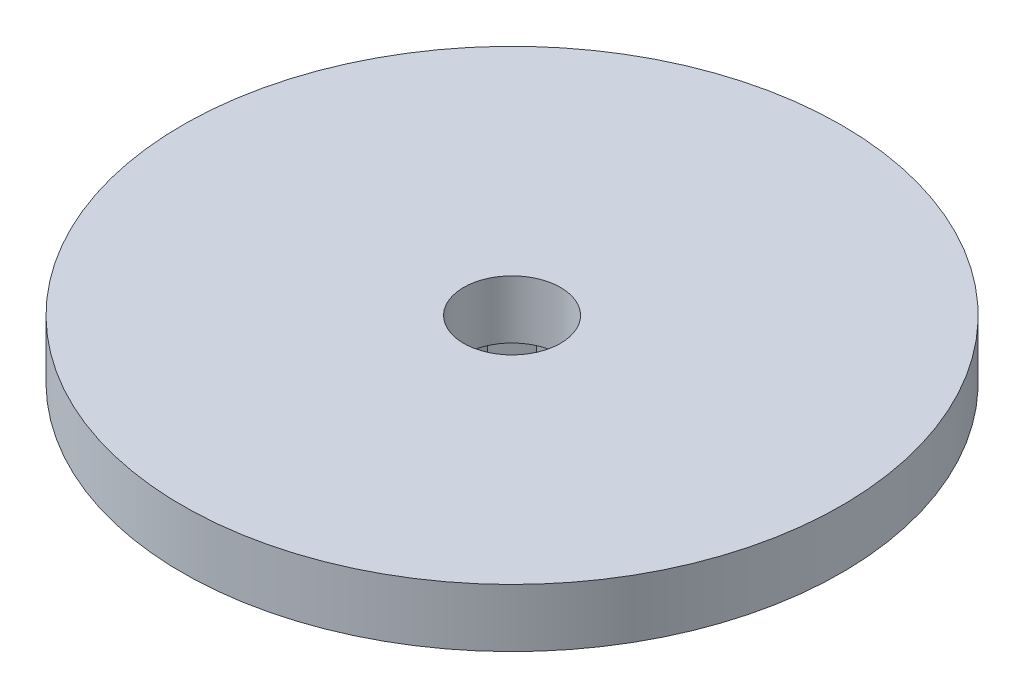
from build123d import *

# Parameters (mm, degrees)
ENL_V_MAT_EXTRU_1_DEPTH = 2.2


with BuildPart() as part:
    # Esquisse1 → Révolution1 (revolve)
    with BuildSketch(Plane.XY, mode=Mode.PRIVATE) as r_volution1_sk:
        Polygon((-8.5, 3.7), (-1.25, 3.7), (-1.25, 2.2), (-2.2, 2.2), (-2.2, 0), (-3.9, 0), (-3.9, 2.2), (-8.5, 2.2), align=None)
    revolve(r_volution1_sk.sketch.rotate(Axis((0, 0, 0), (0, 1, 0)), 270), axis=Axis((0, 0, 0), (0, 1, 0)))

    # Esquisse2 → Enlèv. mat.-Extru.1 (cut)
    with BuildSketch(Plane.XZ):
        Polygon((1.274522619, -1.907457896), (1.907457896, -1.274522619), (2.25, -0.447552827), (2.25, 0.447552827), (1.907457896, 1.274522619), (1.274522619, 1.907457896), (0.447552827, 2.25), (-0.447552827, 2.25), (-1.274522619, 1.907457896), (-1.907457896, 1.274522619), (-2.25, 0.447552827), (-2.25, -0.447552827), (-1.907457896, -1.274522619), (-1.274522619, -1.907457896), (-0.447552827, -2.25), (0.447552827, -2.25), align=None)
    extrude(amount=-ENL_V_MAT_EXTRU_1_DEPTH, mode=Mode.SUBTRACT)


solid = part.part
